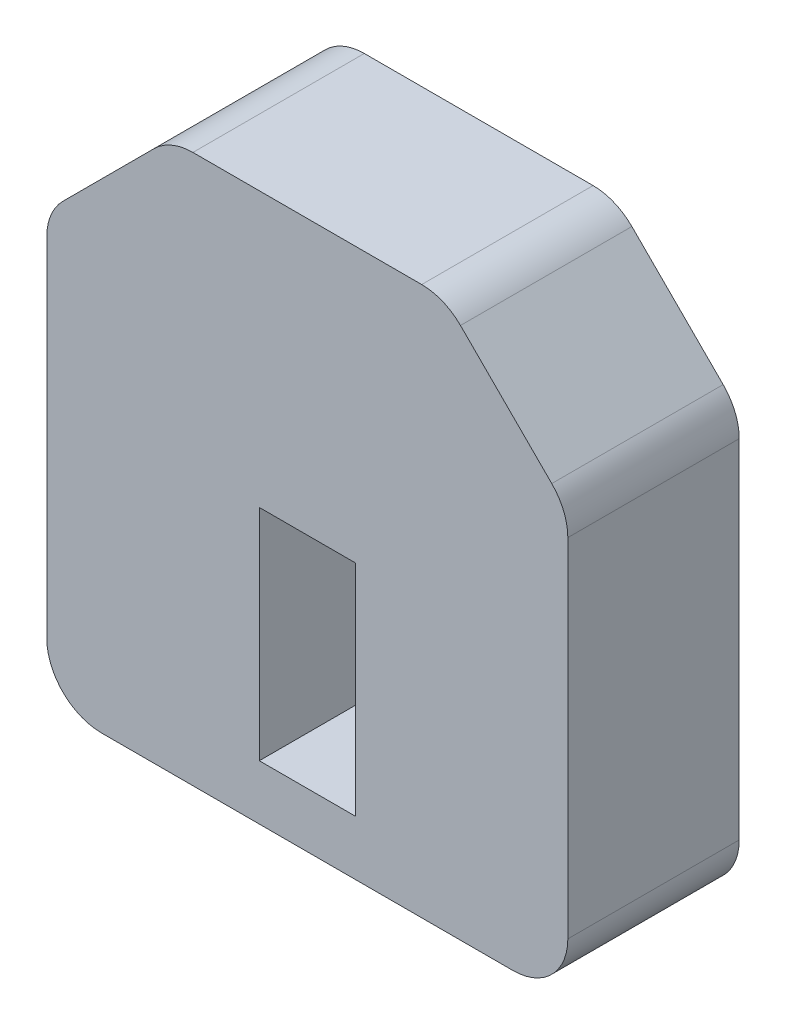
from build123d import *

# Parameters (mm, degrees)
SKETCH1_W           = 38
SKETCH1_H           = 40
BOSS_EXTRUDE1_DEPTH = 12.5
SKETCH2_W           = 7
SKETCH2_H           = 16
CUT_EXTRUDE1_DEPTH  = 12
CHAMFER1_SIZE       = 9
FILLET1_R           = 4


with BuildPart() as part:
    # Sketch1 → Boss-Extrude1 (new body)
    with BuildSketch(Plane.XY):
        Rectangle(SKETCH1_W, SKETCH1_H)
    extrude(amount=BOSS_EXTRUDE1_DEPTH)

    # Sketch2 → Cut-Extrude1 (cut)
    with BuildSketch(Plane.XY.offset(12.5)):
        with Locations((0, -8)):
            Rectangle(SKETCH2_W, SKETCH2_H)
    extrude(amount=-CUT_EXTRUDE1_DEPTH, mode=Mode.SUBTRACT)

    # Chamfer1
    chamfer1_edges = [part.edges().sort_by_distance(p)[0] for p in [
        (-19, 20, 6.25),
        (19, 20, 6.25),
    ]]
    chamfer(chamfer1_edges, length=CHAMFER1_SIZE)

    # Fillet1
    fillet1_edges = [part.edges().sort_by_distance(p)[0] for p in [
        (-10, 20, 6.25),
        (10, 20, 6.25),
        (19, 11, 6.25),
        (-19, 11, 6.25),
        (19, -20, 6.25),
        (-19, -20, 6.25),
    ]]
    fillet(fillet1_edges, radius=FILLET1_R)


solid = part.part
